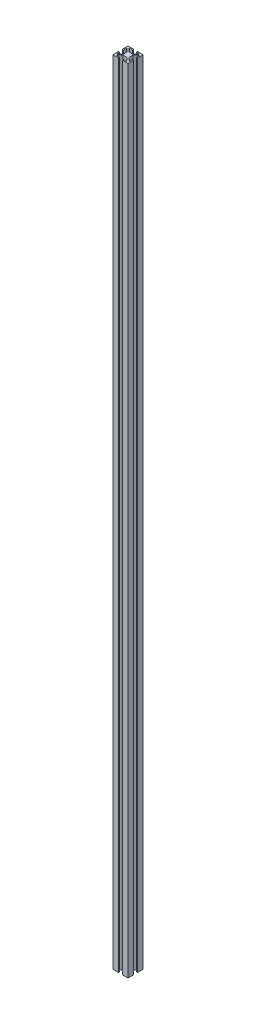
from build123d import *

# Parameters (mm, degrees)
BOSS_EXTRU_1_DEPTH = 1050


with BuildPart() as part:
    # Esquisse1 → Boss.-Extru.1 (new body)
    with BuildSketch(Plane(origin=(0, 0, 0), x_dir=(1, 0, 0), z_dir=(0, 1, 0))):
        with BuildLine():
            Line((-10, -2.5), (-10, -10))
            Line((-10, -10), (-2.5, -10))
            Line((-2.5, -10), (-2.5, -8.5))
            Line((-2.5, -8.5), (-6.232233047, -8.5))
            ThreePointArc((-6.232233047, -8.5), (-6.694172813, -8.191341716), (-6.585786438, -7.646446609))
            Line((-6.585786438, -7.646446609), (-2.689339828, -3.75))
            Line((-2.689339828, -3.75), (2.689339828, -3.75))
            Line((2.689339828, -3.75), (6.585786438, -7.646446609))
            ThreePointArc((6.585786438, -7.646446609), (6.694172813, -8.191341716), (6.232233047, -8.5))
            Line((6.232233047, -8.5), (2.5, -8.5))
            Line((2.5, -8.5), (2.5, -10))
            Line((2.5, -10), (10, -10))
            Line((10, -10), (10, -2.5))
            Line((10, -2.5), (8.5, -2.5))
            Line((8.5, -2.5), (8.5, -6.232233047))
            ThreePointArc((8.5, -6.232233047), (8.191341716, -6.694172813), (7.646446609, -6.585786438))
            Line((7.646446609, -6.585786438), (3.75, -2.689339828))
            Line((3.75, -2.689339828), (3.75, 2.689339828))
            Line((3.75, 2.689339828), (7.646446609, 6.585786438))
            ThreePointArc((7.646446609, 6.585786438), (8.191341716, 6.694172813), (8.5, 6.232233047))
            Line((8.5, 6.232233047), (8.5, 2.5))
            Line((8.5, 2.5), (10, 2.5))
            Line((10, 2.5), (10, 10))
            Line((10, 10), (2.5, 10))
            Line((2.5, 10), (2.5, 8.5))
            Line((2.5, 8.5), (6.232233047, 8.5))
            ThreePointArc((6.232233047, 8.5), (6.694172813, 8.191341716), (6.585786438, 7.646446609))
            Line((6.585786438, 7.646446609), (2.689339828, 3.75))
            Line((2.689339828, 3.75), (-2.689339828, 3.75))
            Line((-2.689339828, 3.75), (-6.585786438, 7.646446609))
            ThreePointArc((-6.585786438, 7.646446609), (-6.694172813, 8.191341716), (-6.232233047, 8.5))
            Line((-6.232233047, 8.5), (-2.5, 8.5))
            Line((-2.5, 8.5), (-2.5, 10))
            Line((-2.5, 10), (-10, 10))
            Line((-10, 10), (-10, 2.5))
            Line((-10, 2.5), (-8.5, 2.5))
            Line((-8.5, 2.5), (-8.5, 6.232233047))
            ThreePointArc((-8.5, 6.232233047), (-8.191341716, 6.694172813), (-7.646446609, 6.585786438))
            Line((-7.646446609, 6.585786438), (-3.75, 2.689339828))
            Line((-3.75, 2.689339828), (-3.75, -2.689339828))
            Line((-3.75, -2.689339828), (-7.646446609, -6.585786438))
            ThreePointArc((-7.646446609, -6.585786438), (-8.191341716, -6.694172813), (-8.5, -6.232233047))
            Line((-8.5, -6.232233047), (-8.5, -2.5))
            Line((-8.5, -2.5), (-10, -2.5))
        make_face()
    extrude(amount=BOSS_EXTRU_1_DEPTH)


solid = part.part
